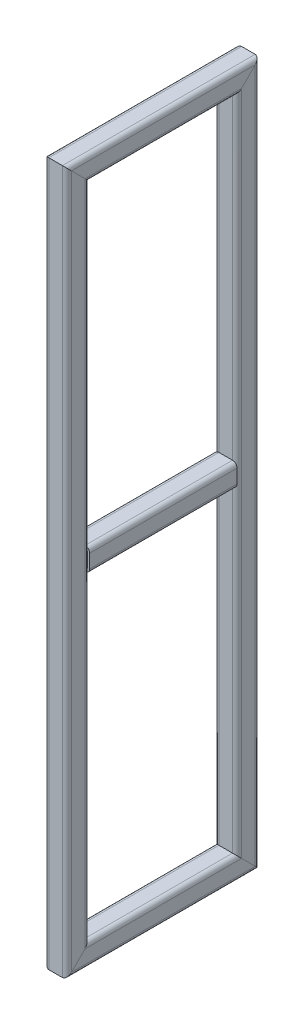
from build123d import *

# Parameters (mm, degrees)
TUBO_CUADRADO_20_X_20_X_2_1_DEPTH      = 615.142135624
TUBO_CUADRADO_20_X_20_X_2_1_DEPTH_BACK = 15.142135624
TUBO_CUADRADO_20_X_20_X_2_1_2_DEPTH    = 180.284271247
TUBO_CUADRADO_20_X_20_X_2_1_3_DEPTH    = 630.284271247
TUBO_CUADRADO_20_X_20_X_2_1_4_DEPTH    = 180.284271247
TUBO_CUADRADO_20_X_20_X_2_1_5_DEPTH    = 152


with BuildPart() as part:
    # Sketch1 → Tubo cuadrado 20 X 20 X 2(1) (new, two sides: drawn at the far end of the back side and taken through both)
    with BuildSketch(Plane(origin=(0, 300, 75), x_dir=(0, 0, -1), z_dir=(0, -1, 0)).offset(-TUBO_CUADRADO_20_X_20_X_2_1_DEPTH_BACK)):
        with BuildLine():
            Line((-6, -10), (6, -10))
            ThreePointArc((6, -10), (8.828427125, -8.828427125), (10, -6))
            Line((10, -6), (10, 6))
            ThreePointArc((10, 6), (8.828427125, 8.828427125), (6, 10))
            Line((6, 10), (-6, 10))
            ThreePointArc((-6, 10), (-8.828427125, 8.828427125), (-10, 6))
            Line((-10, 6), (-10, -6))
            ThreePointArc((-10, -6), (-8.828427125, -8.828427125), (-6, -10))
        make_face()
        with BuildLine():
            Line((-6, -8), (6, -8))
            ThreePointArc((6, -8), (7.414213562, -7.414213562), (8, -6))
            Line((8, -6), (8, 6))
            ThreePointArc((8, 6), (7.414213562, 7.414213562), (6, 8))
            Line((6, 8), (-6, 8))
            ThreePointArc((-6, 8), (-7.414213562, 7.414213562), (-8, 6))
            Line((-8, 6), (-8, -6))
            ThreePointArc((-8, -6), (-7.414213562, -7.414213562), (-6, -8))
        make_face(mode=Mode.SUBTRACT)
    extrude(amount=TUBO_CUADRADO_20_X_20_X_2_1_DEPTH + TUBO_CUADRADO_20_X_20_X_2_1_DEPTH_BACK)

    # Tubo cuadrado 20 X 20 X 2(1) mitre 1
    split(bisect_by=Plane(origin=(0, 300, 75), x_dir=(1, 0, 0), z_dir=(0, -0.707106781, 0.707106781)), keep=Keep.TOP)

    # Tubo cuadrado 20 X 20 X 2(1) mitre 2
    split(bisect_by=Plane(origin=(0, -300, 75), x_dir=(-1, 0, 0), z_dir=(0, 0.707106781, 0.707106781)), keep=Keep.TOP)


with BuildPart() as body_2:
    # Sketch1 on segment 2 (carried to segment 2) → Tubo cuadrado 20 X 20 X 2_1 2 (new body)
    with BuildSketch(Plane(origin=(0, -300, 90.142135624), x_dir=(0, 1, 0), z_dir=(0, 0, -1))):
        with BuildLine():
            Line((-6, -10), (6, -10))
            ThreePointArc((6, -10), (8.828427125, -8.828427125), (10, -6))
            Line((10, -6), (10, 6))
            ThreePointArc((10, 6), (8.828427125, 8.828427125), (6, 10))
            Line((6, 10), (-6, 10))
            ThreePointArc((-6, 10), (-8.828427125, 8.828427125), (-10, 6))
            Line((-10, 6), (-10, -6))
            ThreePointArc((-10, -6), (-8.828427125, -8.828427125), (-6, -10))
        make_face()
        with BuildLine():
            Line((-6, -8), (6, -8))
            ThreePointArc((6, -8), (7.414213562, -7.414213562), (8, -6))
            Line((8, -6), (8, 6))
            ThreePointArc((8, 6), (7.414213562, 7.414213562), (6, 8))
            Line((6, 8), (-6, 8))
            ThreePointArc((-6, 8), (-7.414213562, 7.414213562), (-8, 6))
            Line((-8, 6), (-8, -6))
            ThreePointArc((-8, -6), (-7.414213562, -7.414213562), (-6, -8))
        make_face(mode=Mode.SUBTRACT)
    extrude(amount=TUBO_CUADRADO_20_X_20_X_2_1_2_DEPTH)

    # Tubo cuadrado 20 X 20 X 2_1 2 mitre 1
    split(bisect_by=Plane(origin=(0, -300, 75), x_dir=(1, 0, 0), z_dir=(0, -0.707106781, -0.707106781)), keep=Keep.TOP)

    # Tubo cuadrado 20 X 20 X 2_1 2 mitre 2
    split(bisect_by=Plane(origin=(0, -300, -75), x_dir=(1, 0, 0), z_dir=(0, -0.707106781, 0.707106781)), keep=Keep.TOP)


with BuildPart() as body_3:
    # Sketch1 on segment 3 (carried to segment 3) → Tubo cuadrado 20 X 20 X 2_1 3 (new body)
    with BuildSketch(Plane(origin=(0, -315.142135624, -75), x_dir=(0, 0, 1), z_dir=(0, 1, 0))):
        with BuildLine():
            Line((-6, -10), (6, -10))
            ThreePointArc((6, -10), (8.828427125, -8.828427125), (10, -6))
            Line((10, -6), (10, 6))
            ThreePointArc((10, 6), (8.828427125, 8.828427125), (6, 10))
            Line((6, 10), (-6, 10))
            ThreePointArc((-6, 10), (-8.828427125, 8.828427125), (-10, 6))
            Line((-10, 6), (-10, -6))
            ThreePointArc((-10, -6), (-8.828427125, -8.828427125), (-6, -10))
        make_face()
        with BuildLine():
            Line((-6, -8), (6, -8))
            ThreePointArc((6, -8), (7.414213562, -7.414213562), (8, -6))
            Line((8, -6), (8, 6))
            ThreePointArc((8, 6), (7.414213562, 7.414213562), (6, 8))
            Line((6, 8), (-6, 8))
            ThreePointArc((-6, 8), (-7.414213562, 7.414213562), (-8, 6))
            Line((-8, 6), (-8, -6))
            ThreePointArc((-8, -6), (-7.414213562, -7.414213562), (-6, -8))
        make_face(mode=Mode.SUBTRACT)
    extrude(amount=TUBO_CUADRADO_20_X_20_X_2_1_3_DEPTH)

    # Tubo cuadrado 20 X 20 X 2_1 3 mitre 1
    split(bisect_by=Plane(origin=(0, 300, -75), x_dir=(1, 0, 0), z_dir=(0, -0.707106781, -0.707106781)), keep=Keep.TOP)

    # Tubo cuadrado 20 X 20 X 2_1 3 mitre 2
    split(bisect_by=Plane(origin=(0, -300, -75), x_dir=(-1, 0, 0), z_dir=(0, 0.707106781, -0.707106781)), keep=Keep.TOP)


with BuildPart() as body_4:
    # Sketch1 on segment 4 (carried to segment 4) → Tubo cuadrado 20 X 20 X 2_1 4 (new body)
    with BuildSketch(Plane(origin=(0, 300, -90.142135624), x_dir=(0, -1, 0), z_dir=(0, 0, 1))):
        with BuildLine():
            Line((-6, -10), (6, -10))
            ThreePointArc((6, -10), (8.828427125, -8.828427125), (10, -6))
            Line((10, -6), (10, 6))
            ThreePointArc((10, 6), (8.828427125, 8.828427125), (6, 10))
            Line((6, 10), (-6, 10))
            ThreePointArc((-6, 10), (-8.828427125, 8.828427125), (-10, 6))
            Line((-10, 6), (-10, -6))
            ThreePointArc((-10, -6), (-8.828427125, -8.828427125), (-6, -10))
        make_face()
        with BuildLine():
            Line((-6, -8), (6, -8))
            ThreePointArc((6, -8), (7.414213562, -7.414213562), (8, -6))
            Line((8, -6), (8, 6))
            ThreePointArc((8, 6), (7.414213562, 7.414213562), (6, 8))
            Line((6, 8), (-6, 8))
            ThreePointArc((-6, 8), (-7.414213562, 7.414213562), (-8, 6))
            Line((-8, 6), (-8, -6))
            ThreePointArc((-8, -6), (-7.414213562, -7.414213562), (-6, -8))
        make_face(mode=Mode.SUBTRACT)
    extrude(amount=TUBO_CUADRADO_20_X_20_X_2_1_4_DEPTH)

    # Tubo cuadrado 20 X 20 X 2_1 4 mitre 1
    split(bisect_by=Plane(origin=(0, 300, 75), x_dir=(-1, 0, 0), z_dir=(0, 0.707106781, -0.707106781)), keep=Keep.TOP)

    # Tubo cuadrado 20 X 20 X 2_1 4 mitre 2
    split(bisect_by=Plane(origin=(0, 300, -75), x_dir=(-1, 0, 0), z_dir=(0, 0.707106781, 0.707106781)), keep=Keep.TOP)


with BuildPart() as body_5:
    # Sketch1 on segment 5 (carried to segment 5) → Tubo cuadrado 20 X 20 X 2_1 5 (new body)
    with BuildSketch(Plane.YX.offset(-76)):
        with BuildLine():
            Line((-6, -10), (6, -10))
            ThreePointArc((6, -10), (8.828427125, -8.828427125), (10, -6))
            Line((10, -6), (10, 6))
            ThreePointArc((10, 6), (8.828427125, 8.828427125), (6, 10))
            Line((6, 10), (-6, 10))
            ThreePointArc((-6, 10), (-8.828427125, 8.828427125), (-10, 6))
            Line((-10, 6), (-10, -6))
            ThreePointArc((-10, -6), (-8.828427125, -8.828427125), (-6, -10))
        make_face()
        with BuildLine():
            Line((-6, -8), (6, -8))
            ThreePointArc((6, -8), (7.414213562, -7.414213562), (8, -6))
            Line((8, -6), (8, 6))
            ThreePointArc((8, 6), (7.414213562, 7.414213562), (6, 8))
            Line((6, 8), (-6, 8))
            ThreePointArc((-6, 8), (-7.414213562, 7.414213562), (-8, 6))
            Line((-8, 6), (-8, -6))
            ThreePointArc((-8, -6), (-7.414213562, -7.414213562), (-6, -8))
        make_face(mode=Mode.SUBTRACT)
    extrude(amount=TUBO_CUADRADO_20_X_20_X_2_1_5_DEPTH)

    # Tubo cuadrado 20 X 20 X 2_1 5 mitre 1
    split(bisect_by=Plane.YX.offset(-65), keep=Keep.TOP)

    # Tubo cuadrado 20 X 20 X 2_1 5 mitre 2
    split(bisect_by=Plane(origin=(0, 0, -65), x_dir=(0, -1, 0), z_dir=(0, 0, 1)), keep=Keep.TOP)


solid = Compound([part.part, body_2.part, body_3.part, body_4.part, body_5.part])
